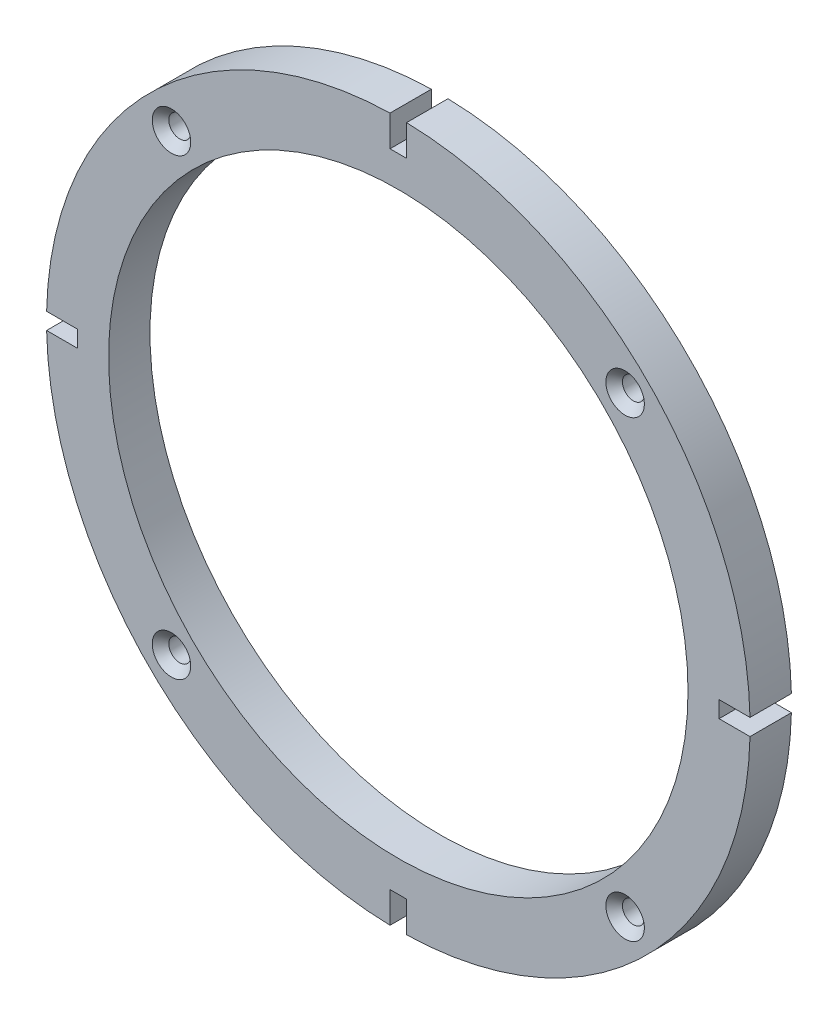
from build123d import *

# Parameters (mm, degrees)
SKETCH1_R                  = 70
BOSS_EXTRUDE1_DEPTH        = 10
SKETCH2_R                  = 2.65
WYTNIJ_WYCI_GNI_CIE1_DEPTH = 10
SZKIC1_R                   = 5
WYTNIJ_WYCI_GNI_CIE2_DEPTH = 2
SZYK_KO_OWY1_COUNT         = 4
SFAZOWANIE1_SIZE           = 2


with BuildPart() as part:
    # Sketch1 → Boss-Extrude1 (new body)
    with BuildSketch(Plane.XY):
        with BuildLine():
            Line((84.976467331, -2), (77.499555144, -2))
            Line((77.499555144, -2), (77.499555144, 2))
            Line((77.499555144, 2), (84.976467331, 2))
            ThreePointArc((84.976467331, 2), (60.104076401, 60.104076401), (2, 84.976467331))
            Line((2, 84.976467331), (2, 77.499555144))
            Line((2, 77.499555144), (-2, 77.499555144))
            Line((-2, 77.499555144), (-2, 84.976467331))
            ThreePointArc((-2, 84.976467331), (-60.104076401, 60.104076401), (-84.976467331, 2))
            Line((-84.976467331, 2), (-77.499555144, 2))
            Line((-77.499555144, 2), (-77.499555144, -2))
            Line((-77.499555144, -2), (-84.976467331, -2))
            ThreePointArc((-84.976467331, -2), (-60.104076401, -60.104076401), (-2, -84.976467331))
            Line((-2, -84.976467331), (-2, -77.499555144))
            Line((-2, -77.499555144), (2, -77.499555144))
            Line((2, -77.499555144), (2, -84.976467331))
            ThreePointArc((2, -84.976467331), (60.104076401, -60.104076401), (84.976467331, -2))
        make_face()
        Circle(SKETCH1_R, mode=Mode.SUBTRACT)
    extrude(amount=BOSS_EXTRUDE1_DEPTH)

    # Sketch2 → Wytnij-wyciągnięcie1 (cut)
    with BuildSketch(Plane(origin=(0, 0, 0), x_dir=(-1, 0, 0), z_dir=(0, 0, -1))):
        with Locations((-54.800775542, 54.800775542)):
            Circle(SKETCH2_R)
        with Locations((54.800775542, 54.800775542)):
            Circle(SKETCH2_R)
        with Locations((54.800775542, -54.800775542)):
            Circle(SKETCH2_R)
        with Locations((-54.800775542, -54.800775542)):
            Circle(SKETCH2_R)
    extrude(amount=-WYTNIJ_WYCI_GNI_CIE1_DEPTH, mode=Mode.SUBTRACT)

    # Szkic1 → Wytnij-wyciągnięcie2 (cut)
    with BuildSketch(Plane(origin=(0, 0, 0), x_dir=(-1, 0, 0), z_dir=(0, 0, -1))):
        with Locations((-54.800775542, 54.800775542)):
            Circle(SZKIC1_R)
    wytnij_wyci_gni_cie2 = extrude(amount=-WYTNIJ_WYCI_GNI_CIE2_DEPTH, mode=Mode.SUBTRACT)

    # Szyk kołowy1: Wytnij-wyciągnięcie2 ×4 about axis
    szyk_ko_owy1_axis = Axis((0, 0, 0), (0, 0, 1))
    for i in range(1, SZYK_KO_OWY1_COUNT):
        add(wytnij_wyci_gni_cie2.rotate(szyk_ko_owy1_axis, i * 360 / SZYK_KO_OWY1_COUNT), mode=Mode.SUBTRACT)

    # Sfazowanie1
    sfazowanie1_edges = [part.edges().sort_by_distance(p)[0] for p in [
        (57.450775542, -54.800775542, 10),
        (-52.150775542, -54.800775542, 10),
        (-52.150775542, 54.800775542, 10),
        (57.450775542, 54.800775542, 10),
    ]]
    chamfer(sfazowanie1_edges, length=SFAZOWANIE1_SIZE)


solid = part.part
